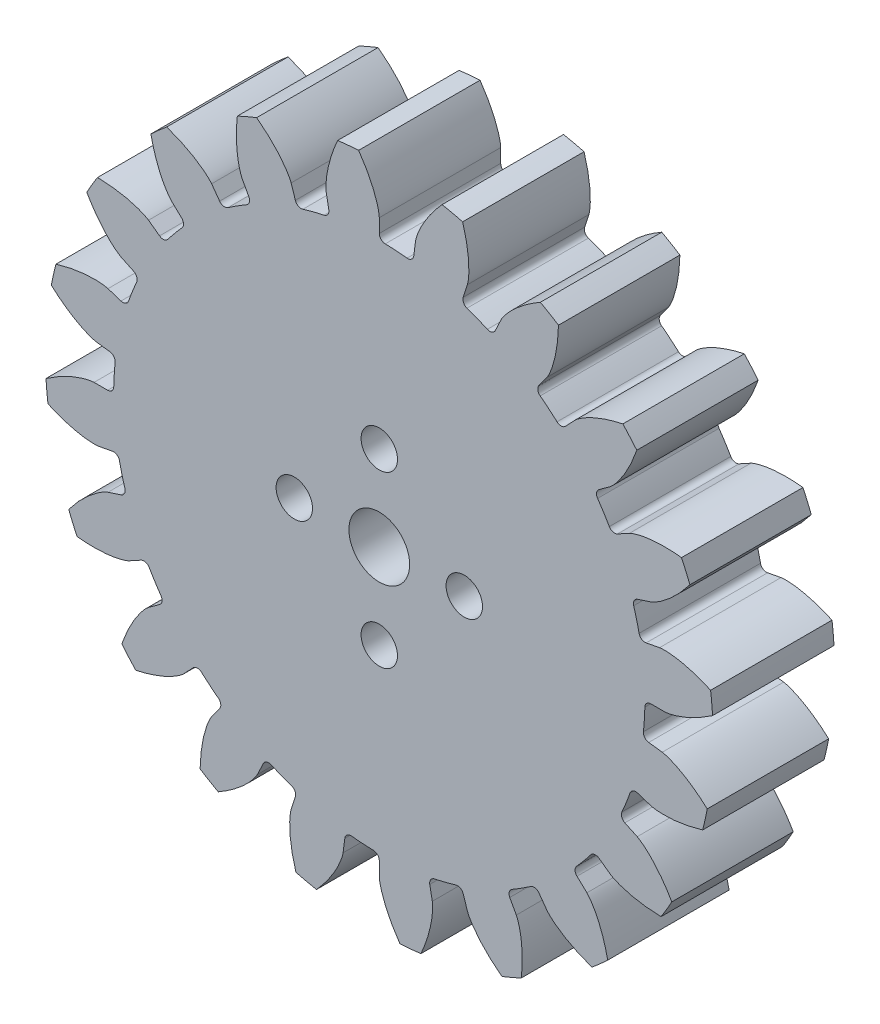
from build123d import *

# Parameters (mm, degrees)
SKETCH1_R           = 27.5
BOSS_EXTRUDE1_DEPTH = 10
CUT_EXTRUDE1_DEPTH  = 41.155946011
CIRPATTERN6_COUNT   = 20
SKETCH3_R           = 2.5
SKETCH3_R_2         = 1.5
CUT_EXTRUDE2_DEPTH  = 10


with BuildPart() as part:
    # Sketch1 → Boss-Extrude1 (new body)
    with BuildSketch(Plane.XY):
        Circle(SKETCH1_R)
    extrude(amount=BOSS_EXTRUDE1_DEPTH)

    # Sketch2 → Cut-Extrude1 (cut, symmetric)
    with BuildSketch(Plane.XY.offset(10)):
        with BuildLine():
            Line((23.49231552, 0), (22.36941271, 0))
            ThreePointArc((22.36941271, 0), (22.019831956, -0.142518118), (21.869537566, -0.488826816))
            ThreePointArc((21.869537566, -0.488826816), (21.830723885, -1.391085782), (21.754702114, -2.290973794))
            ThreePointArc((21.754702114, -2.290973794), (21.859824804, -2.653558043), (22.18848867, -2.839294904))
            Line((22.18848867, -2.839294904), (23.30230943, -2.981822215))
            add(Edge.make_bspline(
                [(23.30230943, -2.981822215), (23.310260749, -2.982956167), (23.332511196, -2.986490812), (23.374367375, -2.994570792), (23.442320766, -3.009732376), (23.528359699, -3.031949065), (23.63887141, -3.063977973), (23.768096607, -3.10595354), (23.90902325, -3.156508958), (24.061085302, -3.216260883), (24.211608727, -3.280051768), (24.36060245, -3.347554552), (24.507936388, -3.418273403), (24.685054198, -3.508016955), (24.895514928, -3.621285348), (25.1385407, -3.761843666), (25.410531044, -3.930837724), (25.683610942, -4.113191596), (25.948855032, -4.300907339), (26.21264073, -4.499956031), (26.464869406, -4.699191067), (26.702507889, -4.898957777), (26.862429549, -5.037478518), (26.966800243, -5.131176062), (27.009633306, -5.170078206)],
                knots=[0, 0, 0, 0, 0, 0.005376749, 0.015083688, 0.02853182, 0.04661014, 0.064854849, 0.092110525, 0.119476176, 0.146842496, 0.174208854, 0.201574956, 0.228941013, 0.256307345, 0.307035032, 0.361767352, 0.416499661, 0.471231937, 0.525964282, 0.580696616, 0.635428982, 0.690161387, 0.728074997, 0.728074997, 0.728074997, 0.728074997, 0.728074997], degree=4))
            ThreePointArc((27.009633306, -5.170078206), (27.377133852, -2.596640529), (27.5, 0))
            ThreePointArc((27.5, 0), (27.486847982, 0.850404607), (27.447404509, 1.699995793))
            add(Edge.make_bspline(
                [(23.49231552, 0), (23.500346458, 0.00011554), (23.522865588, 0.000797402), (23.565408805, 0.003499328), (23.634737011, 0.009913127), (23.72289997, 0.021029415), (23.836583213, 0.038772292), (23.970091091, 0.064006121), (24.116294794, 0.096265172), (24.274711132, 0.136232959), (24.432113944, 0.180402332), (24.588470567, 0.228447743), (24.743589038, 0.279893883), (24.930665246, 0.346430457), (25.153800649, 0.432069467), (25.41270155, 0.540644281), (25.703942036, 0.673748444), (25.997958993, 0.819966071), (26.284884086, 0.972496783), (26.571801047, 1.136453893), (26.847278111, 1.302062744), (27.108350472, 1.470050867), (27.284560783, 1.587152785), (27.399980127, 1.666844985), (27.447404509, 1.699995793)],
                knots=[0, 0, 0, 0, 0, 0.005376749, 0.015083688, 0.02853182, 0.04661014, 0.064854849, 0.092110525, 0.119476176, 0.146842496, 0.174208854, 0.201574956, 0.228941013, 0.256307345, 0.307035032, 0.361767352, 0.416499661, 0.471231937, 0.525964282, 0.580696616, 0.635428982, 0.690161387, 0.728074997, 0.728074997, 0.728074997, 0.728074997, 0.728074997], degree=4))
        make_face()
    cut_extrude1 = extrude(amount=CUT_EXTRUDE1_DEPTH, both=True, mode=Mode.SUBTRACT)

    # CirPattern6: Cut-Extrude1 ×20 about axis
    cirpattern6_axis = Axis((0, 0, 10), (0, 0, -1))
    for i in range(1, CIRPATTERN6_COUNT):
        add(cut_extrude1.rotate(cirpattern6_axis, i * 360 / CIRPATTERN6_COUNT), mode=Mode.SUBTRACT)

    # Sketch3 → Cut-Extrude2 (cut)
    with BuildSketch(Plane.XY.offset(10)):
        Circle(SKETCH3_R)
        with Locations((0, 7)):
            Circle(SKETCH3_R_2)
        with Locations((7, 0)):
            Circle(SKETCH3_R_2)
        with Locations((-7, 0)):
            Circle(SKETCH3_R_2)
        with Locations((0, -7)):
            Circle(SKETCH3_R_2)
    extrude(amount=-CUT_EXTRUDE2_DEPTH, mode=Mode.SUBTRACT)


solid = part.part
